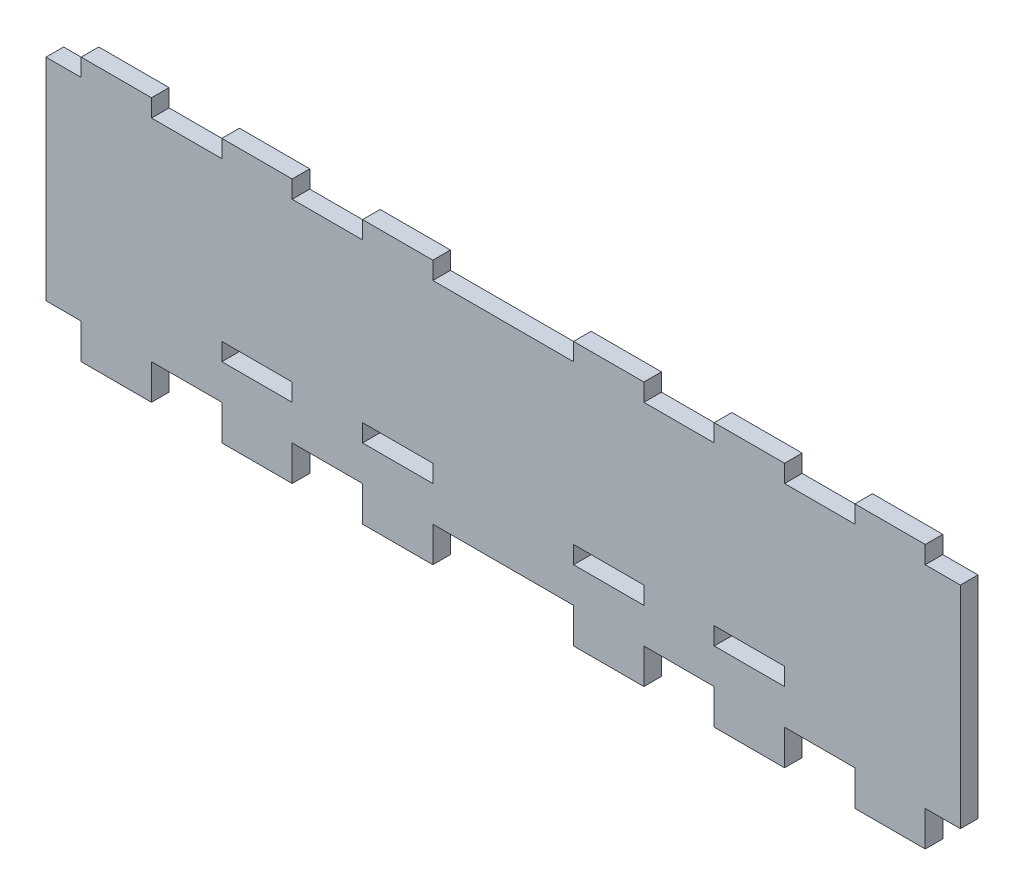
from build123d import *

# Parameters (mm, degrees)
SKETCH1_W           = 10
SKETCH1_H           = 2.5
BOSS_EXTRUDE1_DEPTH = 2.5


with BuildPart() as part:
    # Sketch1 → Boss-Extrude1 (new body)
    with BuildSketch(Plane.XY):
        Polygon((65, -13.75), (60, -13.75), (60, -18.75), (50, -18.75), (50, -13.75), (40, -13.75), (40, -18.75), (30, -18.75), (30, -13.75), (20, -13.75), (20, -18.75), (10, -18.75), (10, -13.75), (-10, -13.75), (-10, -18.75), (-20, -18.75), (-20, -13.75), (-30, -13.75), (-30, -18.75), (-40, -18.75), (-40, -13.75), (-50, -13.75), (-50, -18.75), (-60, -18.75), (-60, -13.75), (-65, -13.75), (-65, 16.25), (-60, 16.25), (-60, 18.75), (-50, 18.75), (-50, 16.25), (-40, 16.25), (-40, 18.75), (-30, 18.75), (-30, 16.25), (-20, 16.25), (-20, 18.75), (-10, 18.75), (-10, 16.25), (10, 16.25), (10, 18.75), (20, 18.75), (20, 16.25), (30, 16.25), (30, 18.75), (40, 18.75), (40, 16.25), (50, 16.25), (50, 18.75), (60, 18.75), (60, 16.25), (65, 16.25), align=None)
        with Locations((-15, -7.5)):
            Rectangle(SKETCH1_W, SKETCH1_H, mode=Mode.SUBTRACT)
        with Locations((-35, -7.5)):
            Rectangle(SKETCH1_W, SKETCH1_H, mode=Mode.SUBTRACT)
        with Locations((15, -7.5)):
            Rectangle(SKETCH1_W, SKETCH1_H, mode=Mode.SUBTRACT)
        with Locations((35, -7.5)):
            Rectangle(SKETCH1_W, SKETCH1_H, mode=Mode.SUBTRACT)
    extrude(amount=BOSS_EXTRUDE1_DEPTH)


solid = part.part
